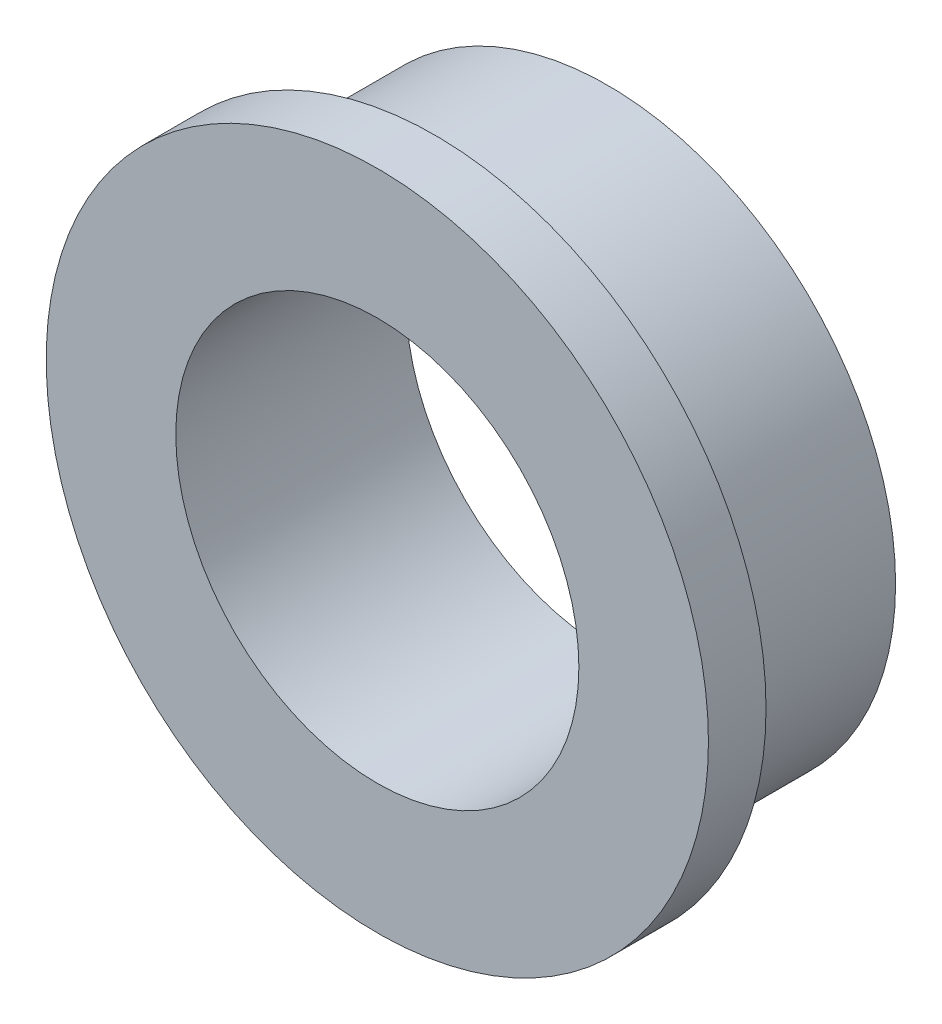
from build123d import *

# Parameters (mm, degrees)
CROQUIS1_R              = 5
CROQUIS1_R_2            = 3.5
SALIENTE_EXTRUIR1_DEPTH = 4
SALIENTE_EXTRUIR2_START = -1
CROQUIS2_R              = 5.75
CROQUIS2_R_2            = 5
SALIENTE_EXTRUIR2_DEPTH = 1


with BuildPart() as part:
    # Croquis1 → Saliente-Extruir1 (new body)
    with BuildSketch(Plane.XY):
        Circle(CROQUIS1_R)
        Circle(CROQUIS1_R_2, mode=Mode.SUBTRACT)
    extrude(amount=SALIENTE_EXTRUIR1_DEPTH)

    # Croquis2 → Saliente-Extruir2 (add)
    with BuildSketch(Plane.XY.offset(4).offset(SALIENTE_EXTRUIR2_START)):
        Circle(CROQUIS2_R)
        Circle(CROQUIS2_R_2, mode=Mode.SUBTRACT)
    extrude(amount=SALIENTE_EXTRUIR2_DEPTH)


solid = part.part
